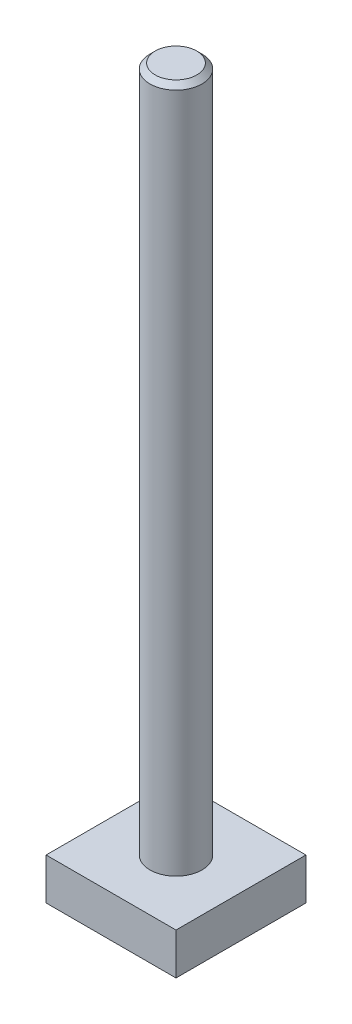
from build123d import *

# Parameters (mm, degrees)
SKETCH1_W           = 25
SKETCH1_H           = 25
BOSS_EXTRUDE1_DEPTH = 8
SKETCH2_R           = 5
BOSS_EXTRUDE2_DEPTH = 132
CHAMFER1_SIZE       = 1


with BuildPart() as part:
    # Sketch1 → Boss-Extrude1 (new body)
    with BuildSketch(Plane(origin=(0, 0, 0), x_dir=(1, 0, 0), z_dir=(0, 1, 0))):
        Rectangle(SKETCH1_W, SKETCH1_H)
    extrude(amount=BOSS_EXTRUDE1_DEPTH)

    # Sketch2 → Boss-Extrude2 (add)
    with BuildSketch(Plane(origin=(0, 8, 0), x_dir=(1, 0, 0), z_dir=(0, 1, 0))):
        with Locations(Location((0, 0, 0), (0, 0, 270))):
            Circle(SKETCH2_R)
    extrude(amount=BOSS_EXTRUDE2_DEPTH)

    # Chamfer1
    chamfer1_edges = [part.edges().sort_by_distance(p)[0] for p in [
        (0, 140, -5),
    ]]
    chamfer(chamfer1_edges, length=CHAMFER1_SIZE)


solid = part.part
